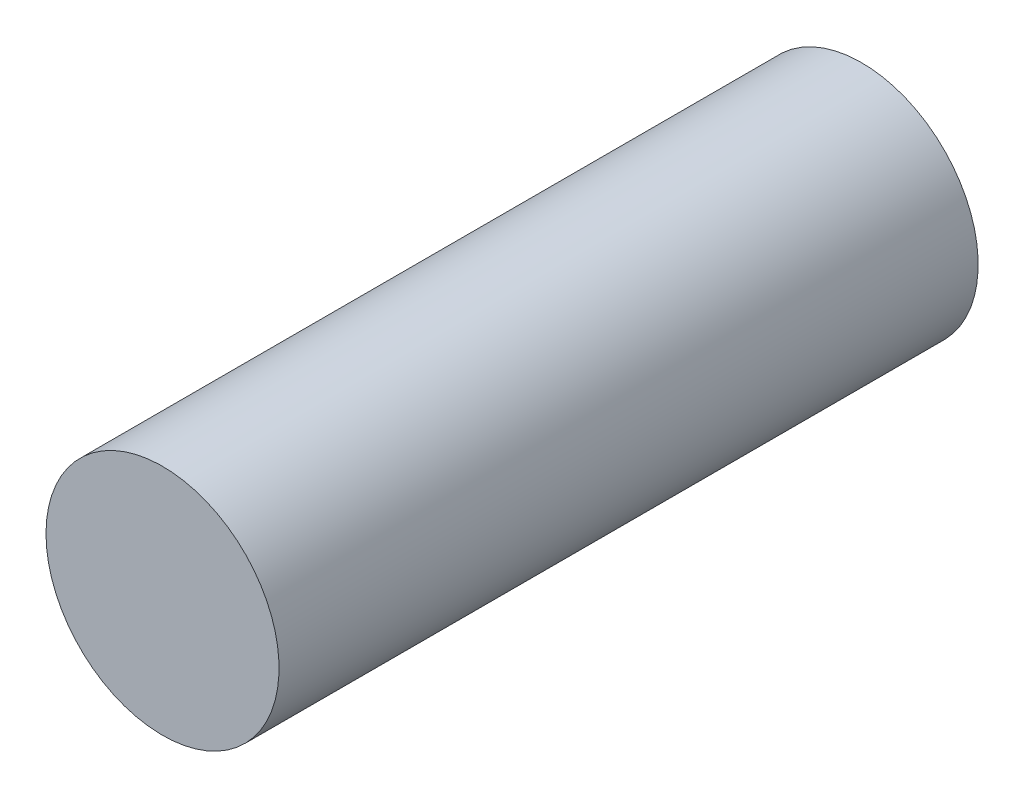
from build123d import *

# Parameters (mm, degrees)
SKETCH1_R           = 6.35
BOSS_EXTRUDE1_DEPTH = 38.1


with BuildPart() as part:
    # Sketch1 → Boss-Extrude1 (new body)
    with BuildSketch(Plane.XY):
        with Locations(Location((0, 0, 0), (0, 0, 180))):
            Circle(SKETCH1_R)
    extrude(amount=BOSS_EXTRUDE1_DEPTH)


solid = part.part
